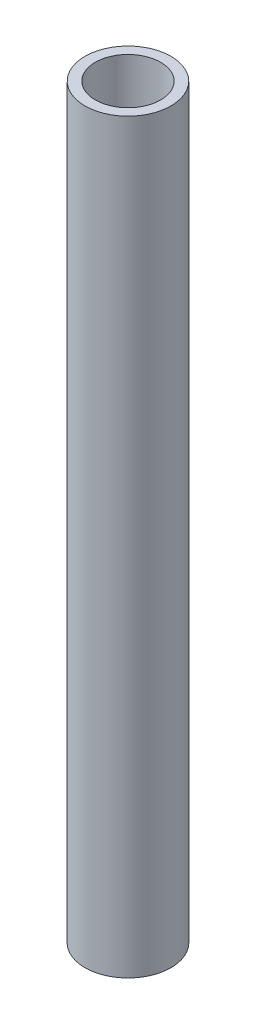
from build123d import *

# Parameters (mm, degrees)
SKETCH_1_R          = 12.5
SKETCH_1_R_2        = 9.5
EXTRUDE_1_DEPTH     = 217
SKETCH_2_R          = 3
CUT_EXTRUDE_1_DEPTH = 218.718855408


with BuildPart() as part:
    # Эскиз1 → Бобышка-Вытянуть1 (new body)
    with BuildSketch(Plane(origin=(0, 0, 0), x_dir=(1, 0, 0), z_dir=(0, 1, 0))):
        with Locations(Location((0, 0, 0), (0, 0, 270))):
            Circle(SKETCH_1_R)
        with Locations(Location((0, 0, 0), (0, 0, 270))):
            Circle(SKETCH_1_R_2, mode=Mode.SUBTRACT)
    extrude(amount=EXTRUDE_1_DEPTH)

    # Эскиз2 → Вырез-Вытянуть1 (cut, through all)
    with BuildSketch(Plane.XY):
        with Locations(Location((0, 202, 0), (0, 0, 90))):
            Circle(SKETCH_2_R)
    extrude(amount=-CUT_EXTRUDE_1_DEPTH, mode=Mode.SUBTRACT)


solid = part.part
